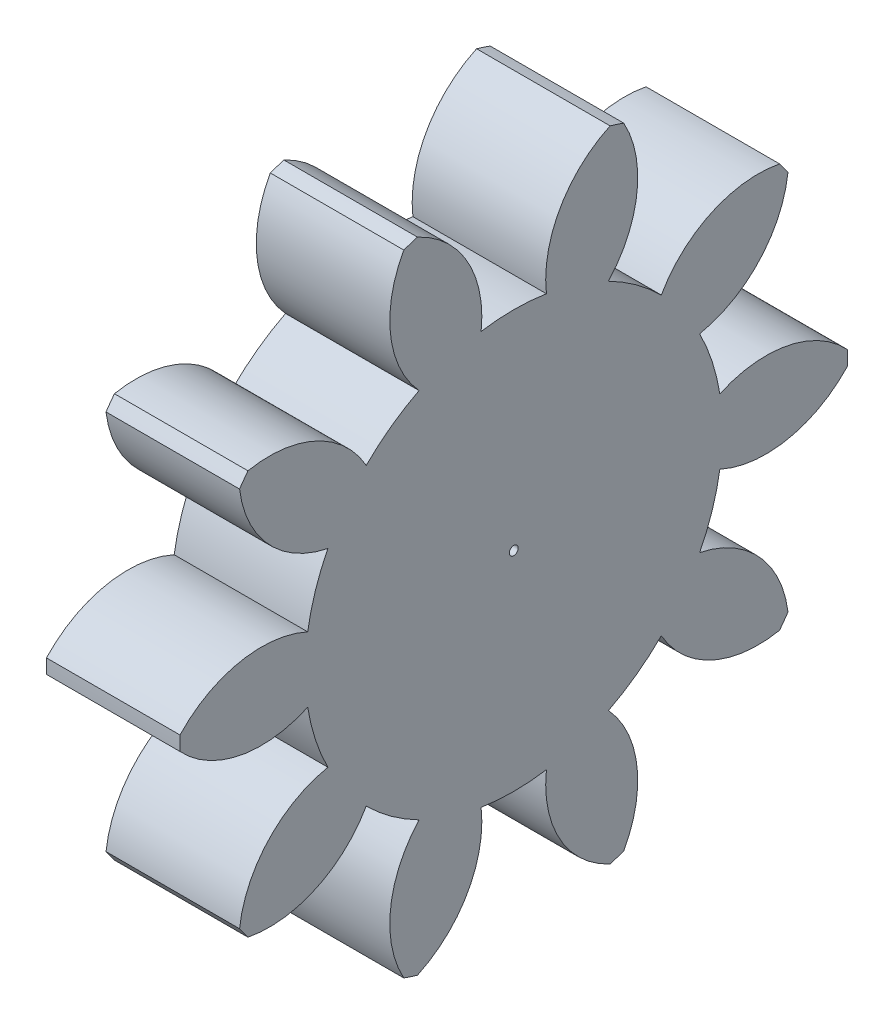
from build123d import *

# Parameters (mm, degrees)
BASPROSKE_W     = 12
BASPROSKE_H     = 30
TOOTHCUT_DEPTH  = 45.09081537
TEETHCUTS_COUNT = 10
TEETHCUTS_ANGLE = 324
BORSKE_R        = 0.4
BORE_DEPTH      = 50.0000508


with BuildPart() as part:
    # BasProSke → Base-Revolve (revolve)
    with BuildSketch(Plane(origin=(0, 0, 0), x_dir=(1, 0, 0), z_dir=(0, 1, 0)), mode=Mode.PRIVATE) as base_revolve_sk:
        with Locations((6, 15)):
            Rectangle(BASPROSKE_W, BASPROSKE_H)
    revolve(base_revolve_sk.sketch.rotate(Axis((-10, 0, 0), (1, 0, 0)), 180), axis=Axis((-10, 0, 0), (1, 0, 0)))

    # TooCutSke → ToothCut (cut, through all)
    with BuildSketch(Plane(origin=(0, 0, 0), x_dir=(0, 0, -1), z_dir=(1, 0, 0))):
        with BuildLine():
            ThreePointArc((2.93332476, 18.51811564), (0, 18.749), (-2.93332476, 18.51811564))
            ThreePointArc((-2.93332476, 18.51811564), (-4.155816835, 24.562157762), (-8.691330358, 28.739962104))
            ThreePointArc((-8.691330358, 28.739962104), (0, 30.0254), (8.691330358, 28.739962104))
            ThreePointArc((8.691330358, 28.739962104), (4.155816835, 24.562157762), (2.93332476, 18.51811564))
        make_face()
    toothcut = extrude(amount=TOOTHCUT_DEPTH, mode=Mode.SUBTRACT)

    # TeethCuts: ToothCut ×10 about axis
    teethcuts_axis = Axis((-10, 0, 0), (1, 0, 0))
    for i in range(1, TEETHCUTS_COUNT):
        add(toothcut.rotate(teethcuts_axis, i * TEETHCUTS_ANGLE / (TEETHCUTS_COUNT - 1)), mode=Mode.SUBTRACT)

    # BorSke → Bore (cut, symmetric)
    with BuildSketch(Plane(origin=(0, 0, 0), x_dir=(0, 0, -1), z_dir=(1, 0, 0))):
        with Locations(Location((0, 0, 0), (0, 0, 180))):
            Circle(BORSKE_R)
    extrude(amount=BORE_DEPTH, both=True, mode=Mode.SUBTRACT)


solid = part.part
